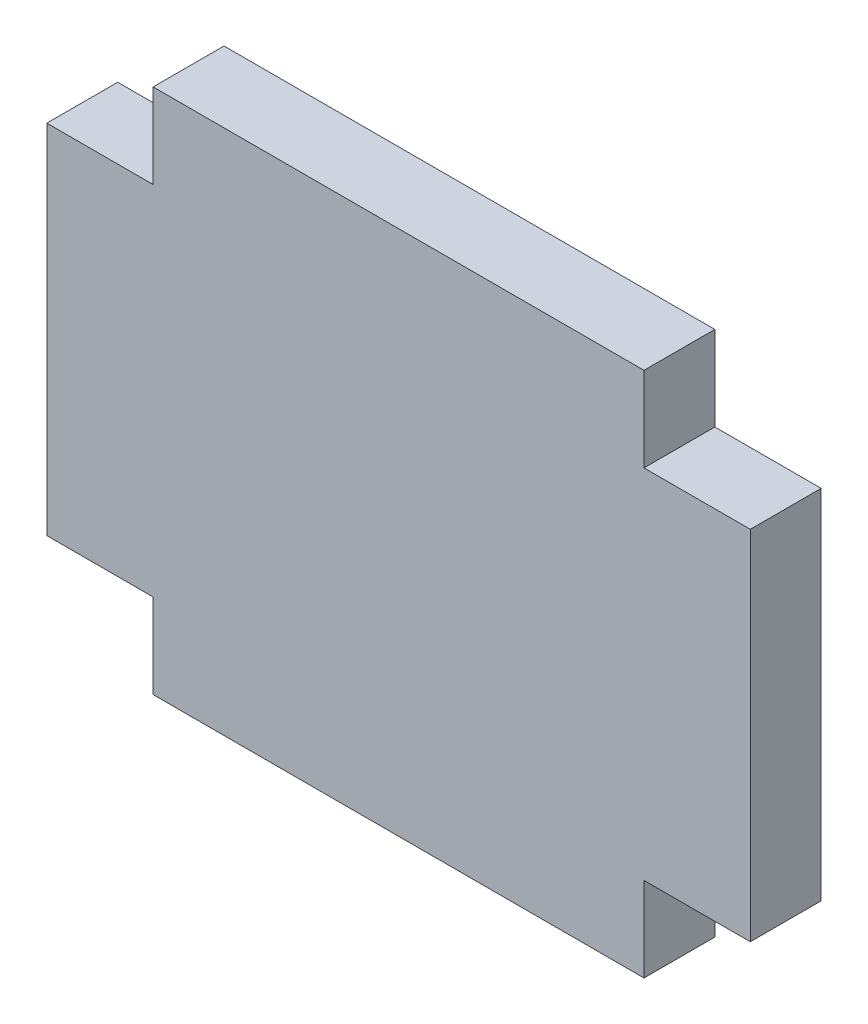
from build123d import *

# Parameters (mm, degrees)
EXTRUDE_1_DEPTH = 4


with BuildPart() as part:
    # 草图1 → 凸台-拉伸1 (new body)
    with BuildSketch(Plane.XY):
        Polygon((58.263097366, -8.658421364), (52.263097366, -8.658421364), (52.263097366, -3.888421364), (24.563097366, -3.888421364), (24.563097366, -8.658421364), (18.563097366, -8.658421364), (18.563097366, -28.818421364), (24.563097366, -28.818421364), (24.563097366, -33.588421364), (52.263097366, -33.588421364), (52.263097366, -28.818421364), (58.263097366, -28.818421364), align=None)
    extrude(amount=EXTRUDE_1_DEPTH)


solid = part.part
